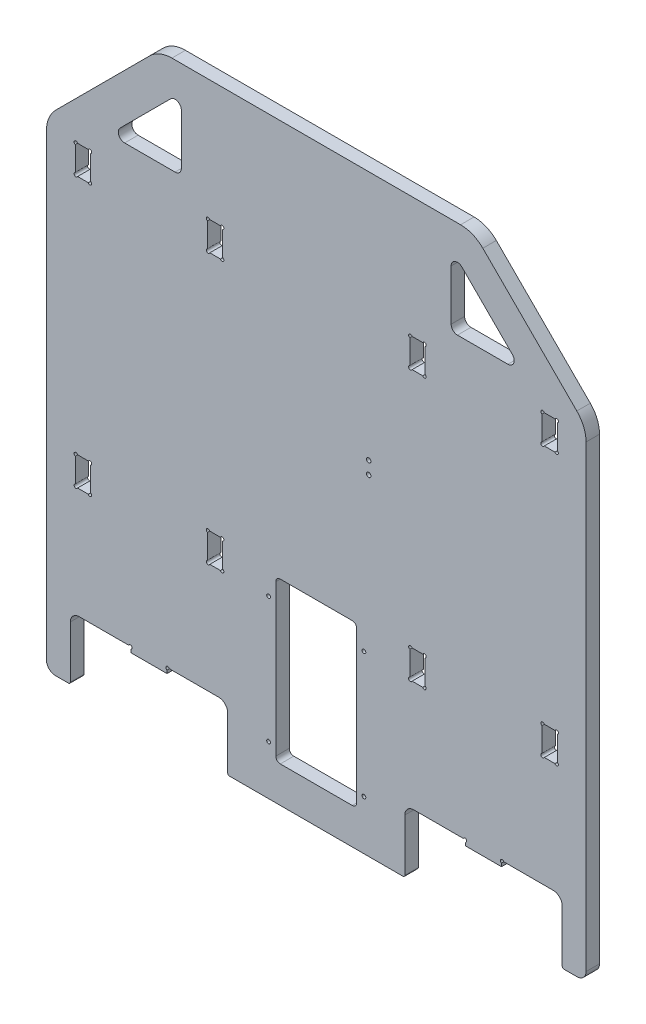
from build123d import *

# Parameters (mm, degrees)
SKETCH1_W           = 600
SKETCH1_H           = 540
BOSS_EXTRUDE1_DEPTH = 15
SKETCH2_W           = 175
SKETCH2_H           = 75.5
CUT_EXTRUDE1_DEPTH  = 404.887360535
SKETCH4_W           = 17
SKETCH4_H           = 32
CUT_EXTRUDE3_DEPTH  = 404.887360535
FILLET3_R           = 10
SKETCH5_W           = 40
SKETCH5_H           = 6
BOSS_EXTRUDE2_DEPTH = 15
SKETCH6_R           = 2.5
CUT_EXTRUDE4_DEPTH  = 404.887360535
BOSS_EXTRUDE3_DEPTH = 15
FILLET4_R           = 35
CUT_EXTRUDE5_DEPTH  = 15
FILLET5_R           = 7
SKETCH9_W           = 600
SKETCH9_H           = 5.5
CUT_EXTRUDE6_DEPTH  = 497.235831032
FILLET7_R           = 10
FILLET8_R           = 2
SKETCH10_W          = 90
SKETCH10_H          = 178
CUT_EXTRUDE7_DEPTH  = 15
FILLET9_R           = 5
SKETCH11_R          = 2.1
CUT_EXTRUDE8_DEPTH  = 15
SKETCH12_R          = 2
CUT_EXTRUDE9_DEPTH  = 497.235831032
SKETCH13_R          = 2
CUT_EXTRUDE10_DEPTH = 497.235831032


with BuildPart() as part:
    # Sketch1 → Boss-Extrude1 (new body)
    with BuildSketch(Plane.XY):
        Rectangle(SKETCH1_W, SKETCH1_H)
    extrude(amount=BOSS_EXTRUDE1_DEPTH)

    # Sketch2 → Cut-Extrude1 (cut, through all)
    with BuildSketch(Plane.XY.offset(15)):
        with Locations((-186, -232.25)):
            Rectangle(SKETCH2_W, SKETCH2_H)
        with Locations((186, -232.25)):
            Rectangle(SKETCH2_W, SKETCH2_H)
    extrude(amount=-CUT_EXTRUDE1_DEPTH, mode=Mode.SUBTRACT)

    # Sketch4 → Cut-Extrude3 (cut, through all)
    with BuildSketch(Plane.XY.offset(15)):
        with Locations((-259.5, 244.5)):
            Rectangle(SKETCH4_W, SKETCH4_H)
        with Locations((-112.5, 244.5)):
            Rectangle(SKETCH4_W, SKETCH4_H)
        with Locations((-259.5, -55.5)):
            Rectangle(SKETCH4_W, SKETCH4_H)
        with Locations((-112.5, -55.5)):
            Rectangle(SKETCH4_W, SKETCH4_H)
        with Locations((112.5, -55.5)):
            Rectangle(SKETCH4_W, SKETCH4_H)
        with Locations((259.5, -55.5)):
            Rectangle(SKETCH4_W, SKETCH4_H)
        with Locations((112.5, 244.5)):
            Rectangle(SKETCH4_W, SKETCH4_H)
        with Locations((259.5, 244.5)):
            Rectangle(SKETCH4_W, SKETCH4_H)
    extrude(amount=-CUT_EXTRUDE3_DEPTH, mode=Mode.SUBTRACT)

    # Fillet3
    fillet3_edges = [part.edges().sort_by_distance(p)[0] for p in [
        (-273.5, -194.5, 7.5),
        (-98.5, -194.5, 7.5),
        (98.5, -194.5, 7.5),
        (273.5, -194.5, 7.5),
    ]]
    fillet(fillet3_edges, radius=FILLET3_R)

    # Sketch5 → Boss-Extrude2 (add)
    with BuildSketch(Plane.XY.offset(15)):
        with Locations((-186, -197.5)):
            Rectangle(SKETCH5_W, SKETCH5_H)
        with Locations((186, -197.5)):
            Rectangle(SKETCH5_W, SKETCH5_H)
    extrude(amount=-BOSS_EXTRUDE2_DEPTH)

    # Sketch6 → Cut-Extrude4 (cut, through all)
    with BuildSketch(Plane.XY.offset(15)):
        with Locations((58.3, 117)):
            Circle(SKETCH6_R)
        with Locations((58.3, 103)):
            Circle(SKETCH6_R)
    extrude(amount=-CUT_EXTRUDE4_DEPTH, mode=Mode.SUBTRACT)

    # Sketch7 → Boss-Extrude3 (add)
    with BuildSketch(Plane.XY.offset(15)):
        Polygon((-300, 270), (300, 270), (175, 395), (-175, 395), align=None)
    extrude(amount=-BOSS_EXTRUDE3_DEPTH)

    # Fillet4
    fillet4_edges = [part.edges().sort_by_distance(p)[0] for p in [
        (-175, 395, 7.5),
        (175, 395, 7.5),
        (-300, 270, 7.5),
        (300, 270, 7.5),
    ]]
    fillet(fillet4_edges, radius=FILLET4_R)

    # Sketch8 → Cut-Extrude5 (cut)
    with BuildSketch(Plane.XY.offset(15)):
        Polygon((-230, 286.966991411), (-150, 286.966991411), (-150, 366.966991411), align=None)
        Polygon((150, 366.966991411), (230, 286.966991411), (150, 286.966991411), align=None)
    extrude(amount=-CUT_EXTRUDE5_DEPTH, mode=Mode.SUBTRACT)

    # Fillet5
    fillet5_edges = [part.edges().sort_by_distance(p)[0] for p in [
        (-230, 286.966991411, 7.5),
        (-150, 366.966991411, 7.5),
        (-150, 286.966991411, 7.5),
        (150, 286.966991411, 7.5),
        (150, 366.966991411, 7.5),
        (230, 286.966991411, 7.5),
    ]]
    fillet(fillet5_edges, radius=FILLET5_R)

    # Sketch9 → Cut-Extrude6 (cut, through all)
    with BuildSketch(Plane.XY.offset(15)):
        with Locations((0, -267.25)):
            Rectangle(SKETCH9_W, SKETCH9_H)
    extrude(amount=-CUT_EXTRUDE6_DEPTH, mode=Mode.SUBTRACT)

    # Fillet7
    fillet7_edges = [part.edges().sort_by_distance(p)[0] for p in [
        (-300, -264.5, 7.5),
        (300, -264.5, 7.5),
    ]]
    fillet(fillet7_edges, radius=FILLET7_R)

    # Fillet8
    fillet8_edges = [part.edges().sort_by_distance(p)[0] for p in [
        (-98.5, -264.5, 7.5),
        (98.5, -264.5, 7.5),
        (273.5, -264.5, 7.5),
        (-273.5, -264.5, 7.5),
    ]]
    fillet(fillet8_edges, radius=FILLET8_R)

    # Sketch10 → Cut-Extrude7 (cut)
    with BuildSketch(Plane.XY.offset(15)):
        with Locations((0, -135.5)):
            Rectangle(SKETCH10_W, SKETCH10_H)
    extrude(amount=-CUT_EXTRUDE7_DEPTH, mode=Mode.SUBTRACT)

    # Fillet9
    fillet9_edges = [part.edges().sort_by_distance(p)[0] for p in [
        (-45, -224.5, 7.5),
        (-45, -46.5, 7.5),
        (45, -46.5, 7.5),
        (45, -224.5, 7.5),
    ]]
    fillet(fillet9_edges, radius=FILLET9_R)

    # Sketch11 → Cut-Extrude8 (cut)
    with BuildSketch(Plane.XY.offset(15)):
        with Locations((53, -69.5)):
            Circle(SKETCH11_R)
        with Locations((53, -209.5)):
            Circle(SKETCH11_R)
        with Locations((-53, -209.5)):
            Circle(SKETCH11_R)
        with Locations((-53, -69.5)):
            Circle(SKETCH11_R)
    extrude(amount=-CUT_EXTRUDE8_DEPTH, mode=Mode.SUBTRACT)

    # Sketch12 → Cut-Extrude9 (cut, through all)
    with BuildSketch(Plane.XY.offset(15)):
        with Locations((-251.707106781, 259.792893219)):
            Circle(SKETCH12_R)
        with Locations((-267.292893219, 259.792893219)):
            Circle(SKETCH12_R)
        with Locations((-267.292893219, 229.207106781)):
            Circle(SKETCH12_R)
        with Locations((-251.707106781, 229.207106781)):
            Circle(SKETCH12_R)
        with Locations((-104.707106781, 259.792893219)):
            Circle(SKETCH12_R)
        with Locations((-120.292893219, 259.792893219)):
            Circle(SKETCH12_R)
        with Locations((-120.292893219, 229.207106781)):
            Circle(SKETCH12_R)
        with Locations((-104.707106781, 229.207106781)):
            Circle(SKETCH12_R)
        with Locations((-104.707106781, -40.207106781)):
            Circle(SKETCH12_R)
        with Locations((-120.292893219, -40.207106781)):
            Circle(SKETCH12_R)
        with Locations((-120.292893219, -70.792893219)):
            Circle(SKETCH12_R)
        with Locations((-104.707106781, -70.792893219)):
            Circle(SKETCH12_R)
        with Locations((-251.707106781, -40.207106781)):
            Circle(SKETCH12_R)
        with Locations((-267.292893219, -40.207106781)):
            Circle(SKETCH12_R)
        with Locations((-267.292893219, -70.792893219)):
            Circle(SKETCH12_R)
        with Locations((-251.707106781, -70.792893219)):
            Circle(SKETCH12_R)
        with Locations((251.707106781, -70.792893219)):
            Circle(SKETCH12_R)
        with Locations((267.292893219, -70.792893219)):
            Circle(SKETCH12_R)
        with Locations((267.292893219, -40.207106781)):
            Circle(SKETCH12_R)
        with Locations((251.707106781, -40.207106781)):
            Circle(SKETCH12_R)
        with Locations((104.707106781, -70.792893219)):
            Circle(SKETCH12_R)
        with Locations((120.292893219, -70.792893219)):
            Circle(SKETCH12_R)
        with Locations((120.292893219, -40.207106781)):
            Circle(SKETCH12_R)
        with Locations((104.707106781, -40.207106781)):
            Circle(SKETCH12_R)
        with Locations((104.707106781, 229.207106781)):
            Circle(SKETCH12_R)
        with Locations((120.292893219, 229.207106781)):
            Circle(SKETCH12_R)
        with Locations((120.292893219, 259.792893219)):
            Circle(SKETCH12_R)
        with Locations((104.707106781, 259.792893219)):
            Circle(SKETCH12_R)
        with Locations((251.707106781, 229.207106781)):
            Circle(SKETCH12_R)
        with Locations((267.292893219, 229.207106781)):
            Circle(SKETCH12_R)
        with Locations((267.292893219, 259.792893219)):
            Circle(SKETCH12_R)
        with Locations((251.707106781, 259.792893219)):
            Circle(SKETCH12_R)
    extrude(amount=-CUT_EXTRUDE9_DEPTH, mode=Mode.SUBTRACT)

    # Sketch13 → Cut-Extrude10 (cut, through all)
    with BuildSketch(Plane.XY.offset(15)):
        with Locations((-206.707106781, -195.207106781)):
            Circle(SKETCH13_R)
        with Locations((-165.292893219, -195.207106781)):
            Circle(SKETCH13_R)
        with Locations((165.292893219, -195.207106781)):
            Circle(SKETCH13_R)
        with Locations((206.707106781, -195.207106781)):
            Circle(SKETCH13_R)
    extrude(amount=-CUT_EXTRUDE10_DEPTH, mode=Mode.SUBTRACT)


solid = part.part
